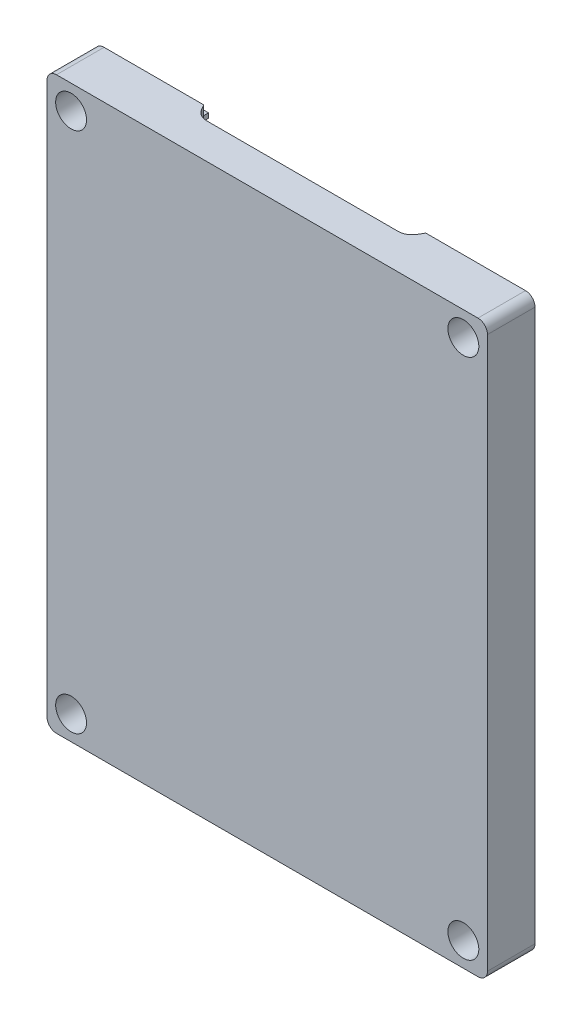
from build123d import *

# Parameters (mm, degrees)
ESQUISSE1_R       = 1.6
WALLS_DEPTH       = 10
CENTRAGE_DEPTH    = 1
PASSAGE_CMC_REACH = 130.98
COUVERCLE_DEPTH   = 2
PASSAGE_M3_START  = -5
ESQUISSE5_R       = 3.25
ESQUISSE5_R_2     = 1.6
PASSAGE_M3_DEPTH  = 5


with BuildPart() as part:
    # Esquisse1 → Walls (new body)
    with BuildSketch(Plane.XY):
        with BuildLine():
            Line((-44.32, 60.43), (44.32, 60.43))
            ThreePointArc((44.32, 60.43), (45.734213562, 59.844213562), (46.32, 58.43))
            Line((46.32, 58.43), (46.32, -57.53))
            ThreePointArc((46.32, -57.53), (45.734213562, -58.944213562), (44.32, -59.53))
            Line((44.32, -59.53), (-44.32, -59.53))
            ThreePointArc((-44.32, -59.53), (-45.734213562, -58.944213562), (-46.32, -57.53))
            Line((-46.32, -57.53), (-46.32, 58.43))
            ThreePointArc((-46.32, 58.43), (-45.734213562, 59.844213562), (-44.32, 60.43))
        make_face()
        with Locations((-41.248784258, -54.458784258)):
            Circle(ESQUISSE1_R, mode=Mode.SUBTRACT)
        with Locations((41.248784258, -54.458784258)):
            Circle(ESQUISSE1_R, mode=Mode.SUBTRACT)
        with Locations((41.248784258, 55.358784258)):
            Circle(ESQUISSE1_R, mode=Mode.SUBTRACT)
        with Locations((-41.248784258, 55.358784258)):
            Circle(ESQUISSE1_R, mode=Mode.SUBTRACT)
        Polygon((-43.37, 46.065786438), (-31.955786438, 57.48), (31.955786438, 57.48), (43.37, 46.065786438), (43.37, -45.165786438), (31.955786438, -56.58), (-31.955786438, -56.58), (-43.37, -45.165786438), align=None, mode=Mode.SUBTRACT)
    extrude(amount=WALLS_DEPTH)

    # Esquisse1<5> → Centrage (add)
    with BuildSketch(Plane.XY):
        Polygon((-44.37, 46.48), (-32.37, 58.48), (32.37, 58.48), (44.37, 46.48), (44.37, -45.58), (32.37, -57.58), (-32.37, -57.58), (-44.37, -45.58), align=None)
        Polygon((-31.955786438, -56.58), (-43.37, -45.165786438), (-43.37, 46.065786438), (-31.955786438, 57.48), (31.955786438, 57.48), (43.37, 46.065786438), (43.37, -45.165786438), (31.955786438, -56.58), align=None, mode=Mode.SUBTRACT)
    extrude(amount=-CENTRAGE_DEPTH)

    # Esquisse2 → Passage_CMC (cut, up to next)
    with BuildSketch(Plane(origin=(0, 60.43, 0), x_dir=(1, 0, 0), z_dir=(0, 1, 0)), mode=Mode.PRIVATE) as passage_cmc_sk1:
        with BuildLine():
            Line((-23.35, 1), (23.35, 1))
            Line((23.35, 1), (23.35, 0))
            Line((23.35, 0), (22.72, -1.1))
            ThreePointArc((22.72, -1.1), (21.621090793, -2.198557375), (20.12, -2.6))
            Line((20.12, -2.6), (-20.12, -2.6))
            ThreePointArc((-20.12, -2.6), (-21.621090793, -2.198557375), (-22.72, -1.1))
            Line((-22.72, -1.1), (-23.35, 0))
            Line((-23.35, 0), (-23.35, 1))
        make_face()
    passage_cmc_tool1 = extrude(passage_cmc_sk1.sketch, amount=-PASSAGE_CMC_REACH, mode=Mode.PRIVATE) & part.part
    add(passage_cmc_tool1.solids().sort_by_distance((0, 60.43, 0.768983))[0], mode=Mode.SUBTRACT)

    # Esquisse4 → Couvercle (add)
    with BuildSketch(Plane.XY.offset(10)):
        Polygon((-43.37, -45.165786438), (-43.37, 46.065786438), (-31.955786438, 57.48), (31.955786438, 57.48), (43.37, 46.065786438), (43.37, -45.165786438), (31.955786438, -56.58), (-31.955786438, -56.58), align=None)
    extrude(amount=-COUVERCLE_DEPTH)

    # Esquisse5 → Passage_M3 (cut)
    # profile 1 of 4: a face of its own
    with BuildSketch(Plane.XY.offset(10).offset(PASSAGE_M3_START)):
        with Locations((-41.248784258, -54.458784258)):
            Circle(ESQUISSE5_R)
        with Locations((-41.248784258, -54.458784258)):
            Circle(ESQUISSE5_R_2, mode=Mode.SUBTRACT)
    # profile 2 of 4: a face of its own
    with BuildSketch(Plane.XY.offset(10).offset(PASSAGE_M3_START)):
        with Locations((-41.248784258, 55.358784258)):
            Circle(ESQUISSE5_R)
        with Locations((-41.248784258, 55.358784258)):
            Circle(ESQUISSE5_R_2, mode=Mode.SUBTRACT)
    # profile 3 of 4: a face of its own
    with BuildSketch(Plane.XY.offset(10).offset(PASSAGE_M3_START)):
        with Locations(Location((41.248784258, 55.358784258, 0), (0, 0, 180))):
            Circle(ESQUISSE5_R)
        with Locations(Location((41.248784258, 55.358784258, 0), (0, 0, 180))):
            Circle(ESQUISSE5_R_2, mode=Mode.SUBTRACT)
    # profile 4 of 4: a face of its own
    with BuildSketch(Plane.XY.offset(10).offset(PASSAGE_M3_START)):
        with Locations(Location((41.248784258, -54.458784258, 0), (0, 0, 180))):
            Circle(ESQUISSE5_R)
        with Locations(Location((41.248784258, -54.458784258, 0), (0, 0, 180))):
            Circle(ESQUISSE5_R_2, mode=Mode.SUBTRACT)
    extrude(amount=PASSAGE_M3_DEPTH, mode=Mode.SUBTRACT)


solid = part.part
